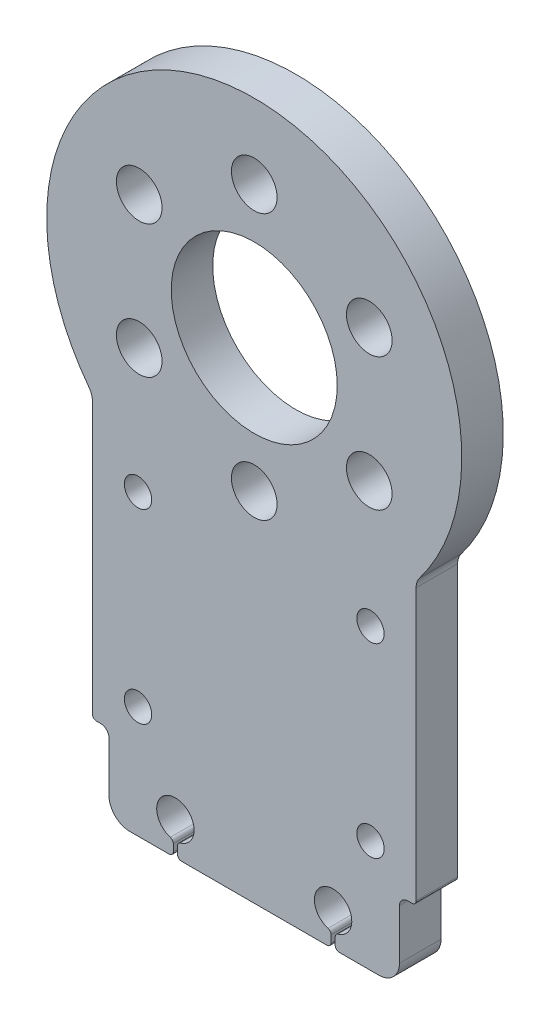
from build123d import *

# Parameters (mm, degrees)
SKETCH_1_R      = 10
SKETCH_1_R_2    = 2.75
SKETCH_1_R_3    = 1.65
EXTRUDE_1_DEPTH = 5


with BuildPart() as part:
    # 草图1 → 凸台-拉伸1 (new body)
    with BuildSketch(Plane(origin=(0, 0, 0), x_dir=(-1, 0, 0), z_dir=(0, 0, -1))):
        with BuildLine():
            Line((-15, -59), (-10.25, -59))
            ThreePointArc((-10.25, -59), (-9.896446609, -58.853553391), (-9.75, -58.5))
            Line((-9.75, -58.5), (-9.75, -57.645751311))
            ThreePointArc((-9.75, -57.645751311), (-9.851137982, -57.344239966), (-10.113636364, -57.164705618))
            ThreePointArc((-10.113636364, -57.164705618), (-9.5, -52.75), (-8.886363636, -57.164705618))
            ThreePointArc((-8.886363636, -57.164705618), (-9.148862018, -57.344239966), (-9.25, -57.645751311))
            Line((-9.25, -57.645751311), (-9.25, -58.5))
            ThreePointArc((-9.25, -58.5), (-9.103553391, -58.853553391), (-8.75, -59))
            Line((-8.75, -59), (8.75, -59))
            ThreePointArc((8.75, -59), (9.103553391, -58.853553391), (9.25, -58.5))
            Line((9.25, -58.5), (9.25, -57.645751311))
            ThreePointArc((9.25, -57.645751311), (9.148862018, -57.344239966), (8.886363636, -57.164705618))
            ThreePointArc((8.886363636, -57.164705618), (9.5, -52.75), (10.113636364, -57.164705618))
            ThreePointArc((10.113636364, -57.164705618), (9.851137982, -57.344239966), (9.75, -57.645751311))
            Line((9.75, -57.645751311), (9.75, -58.5))
            ThreePointArc((9.75, -58.5), (9.896446609, -58.853553391), (10.25, -59))
            Line((10.25, -59), (15, -59))
            ThreePointArc((15, -59), (16.767766953, -58.267766953), (17.5, -56.5))
            Line((17.5, -56.5), (17.5, -50.5))
            ThreePointArc((17.5, -50.5), (17.792893219, -49.792893219), (18.5, -49.5))
            Line((18.5, -49.5), (19, -49.5))
            ThreePointArc((19, -49.5), (19.353553391, -49.353553391), (19.5, -49))
            Line((19.5, -49), (19.5, -16.332482971))
            ThreePointArc((19.5, -16.332482971), (19.604586432, -15.694198233), (19.907407407, -15.122669418))
            ThreePointArc((19.907407407, -15.122669418), (0, 25), (-19.907407407, -15.122669418))
            ThreePointArc((-19.907407407, -15.122669418), (-19.604586432, -15.694198233), (-19.5, -16.332482971))
            Line((-19.5, -16.332482971), (-19.5, -49))
            ThreePointArc((-19.5, -49), (-19.353553391, -49.353553391), (-19, -49.5))
            Line((-19, -49.5), (-18.5, -49.5))
            ThreePointArc((-18.5, -49.5), (-17.792893219, -49.792893219), (-17.5, -50.5))
            Line((-17.5, -50.5), (-17.5, -56.5))
            ThreePointArc((-17.5, -56.5), (-16.767766953, -58.267766953), (-15, -59))
        make_face()
        with Locations(Location((0, 0, 0), (0, 0, 180))):
            Circle(SKETCH_1_R, mode=Mode.SUBTRACT)
        with Locations(Location((13.856406461, 8, 0), (0, 0, 180))):
            Circle(SKETCH_1_R_2, mode=Mode.SUBTRACT)
        with Locations(Location((13.856406461, -8, 0), (0, 0, 180))):
            Circle(SKETCH_1_R_2, mode=Mode.SUBTRACT)
        with Locations(Location((0, -16, 0), (0, 0, 180))):
            Circle(SKETCH_1_R_2, mode=Mode.SUBTRACT)
        with Locations(Location((-13.856406461, -8, 0), (0, 0, 180))):
            Circle(SKETCH_1_R_2, mode=Mode.SUBTRACT)
        with Locations(Location((-13.856406461, 8, 0), (0, 0, 180))):
            Circle(SKETCH_1_R_2, mode=Mode.SUBTRACT)
        with Locations(Location((0, 16, 0), (0, 0, 180))):
            Circle(SKETCH_1_R_2, mode=Mode.SUBTRACT)
        with Locations(Location((14, -23.086792761, 0), (0, 0, 180))):
            Circle(SKETCH_1_R_3, mode=Mode.SUBTRACT)
        with Locations(Location((-14, -23.086792761, 0), (0, 0, 180))):
            Circle(SKETCH_1_R_3, mode=Mode.SUBTRACT)
        with Locations(Location((-14, -45.5, 0), (0, 0, 180))):
            Circle(SKETCH_1_R_3, mode=Mode.SUBTRACT)
        with Locations(Location((14, -45.5, 0), (0, 0, 180))):
            Circle(SKETCH_1_R_3, mode=Mode.SUBTRACT)
    extrude(amount=-EXTRUDE_1_DEPTH)


solid = part.part
